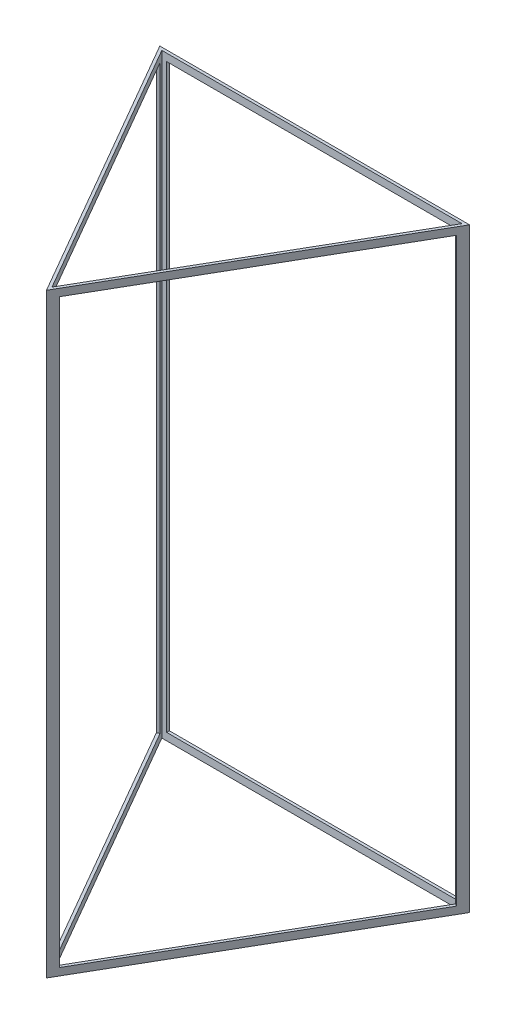
from build123d import *

# Parameters (mm, degrees)
BOSS_EXTRUDE2_DEPTH = 2500
SKETCH4_W           = 1219.2
SKETCH4_H           = 2438.4
CUT_EXTRUDE2_DEPTH  = 21
SKETCH5_W           = 1219.2
SKETCH5_H           = 2438.4
CUT_EXTRUDE3_DEPTH  = 21
SKETCH6_W           = 1219.2
SKETCH6_H           = 2438.4
CUT_EXTRUDE4_DEPTH  = 21


with BuildPart() as part:
    # Sketch1 → Boss-Extrude2 (new body)
    with BuildSketch(Plane(origin=(0, 0, 0), x_dir=(1, 0, 0), z_dir=(0, 1, 0))):
        Polygon((0, 0), (650, 1125.83302492), (-650, 1125.83302492), align=None)
        Polygon((0, 23.094010768), (630, 1114.286019536), (-630, 1114.286019536), align=None, mode=Mode.SUBTRACT)
    extrude(amount=BOSS_EXTRUDE2_DEPTH)

    # Sketch4 → Cut-Extrude2 (cut)
    with BuildSketch(Plane(origin=(0, 0, -1125.83302492), x_dir=(-1, 0, 0), z_dir=(0, 0, -1))):
        with Locations((0, 1250)):
            Rectangle(SKETCH4_W, SKETCH4_H)
    extrude(amount=-CUT_EXTRUDE2_DEPTH, mode=Mode.SUBTRACT)

    # Sketch5 → Cut-Extrude3 (cut)
    with BuildSketch(Plane(origin=(0, 0, 0), x_dir=(0.5000000000000001, 0, 0.8660254037844386), z_dir=(-0.8660254037844386, 0, 0.5000000000000001))):
        with Locations((-650, 1250)):
            Rectangle(SKETCH5_W, SKETCH5_H)
    extrude(amount=-CUT_EXTRUDE3_DEPTH, mode=Mode.SUBTRACT)

    # Sketch6 → Cut-Extrude4 (cut)
    with BuildSketch(Plane(origin=(0, 0, 0), x_dir=(0.4999999999999999, 0, -0.8660254037844386), z_dir=(0.8660254037844387, 0, 0.49999999999999994))):
        with Locations((650, 1250)):
            Rectangle(SKETCH6_W, SKETCH6_H)
    extrude(amount=-CUT_EXTRUDE4_DEPTH, mode=Mode.SUBTRACT)


solid = part.part
